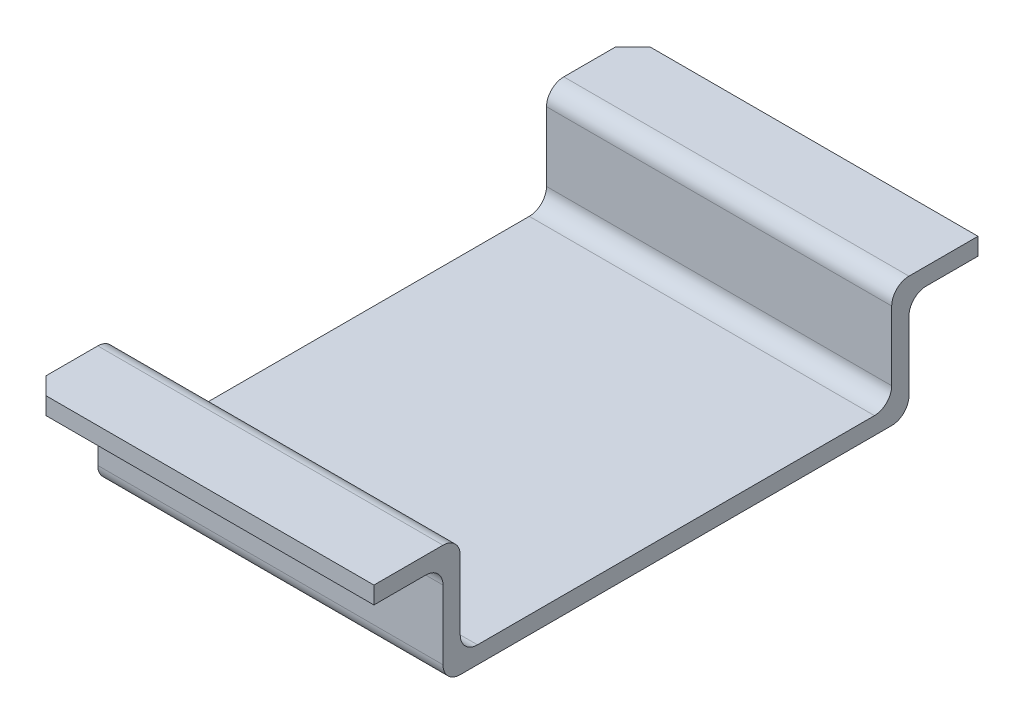
from build123d import *

# Parameters (mm, degrees)
EXTRUDE_1_DEPTH = 20
FILLET_1_R      = 1
CHAMFER_1_SIZE  = 1


with BuildPart() as part:
    # 草图1 → 凸台-拉伸1 (new body)
    with BuildSketch(Plane(origin=(0, 0, 0), x_dir=(0, 0, -1), z_dir=(1, 0, 0))):
        Polygon((0, 0), (-12.5, 0), (-12.5, 6), (-17.5, 6), (-17.5, 5), (-13.5, 5), (-13.5, -1), (0, -1), (13.5, -1), (13.5, 5), (17.5, 5), (17.5, 6), (12.5, 6), (12.5, 0), align=None)
    extrude(amount=EXTRUDE_1_DEPTH)

    # 圆角1
    fillet_1_edges = [part.edges().sort_by_distance(p)[0] for p in [
        (10, -1, -13.5),
        (10, -1, 13.5),
        (10, 5, 13.5),
        (10, 6, 12.5),
        (10, 0, 12.5),
        (10, 0, -12.5),
        (10, 6, -12.5),
        (10, 5, -13.5),
    ]]
    fillet(fillet_1_edges, radius=FILLET_1_R)

    # 倒角1
    chamfer_1_edges = [part.edges().sort_by_distance(p)[0] for p in [
        (0, 5.5, 17.5),
        (0, 5.5, -17.5),
    ]]
    chamfer(chamfer_1_edges, length=CHAMFER_1_SIZE)


solid = part.part
